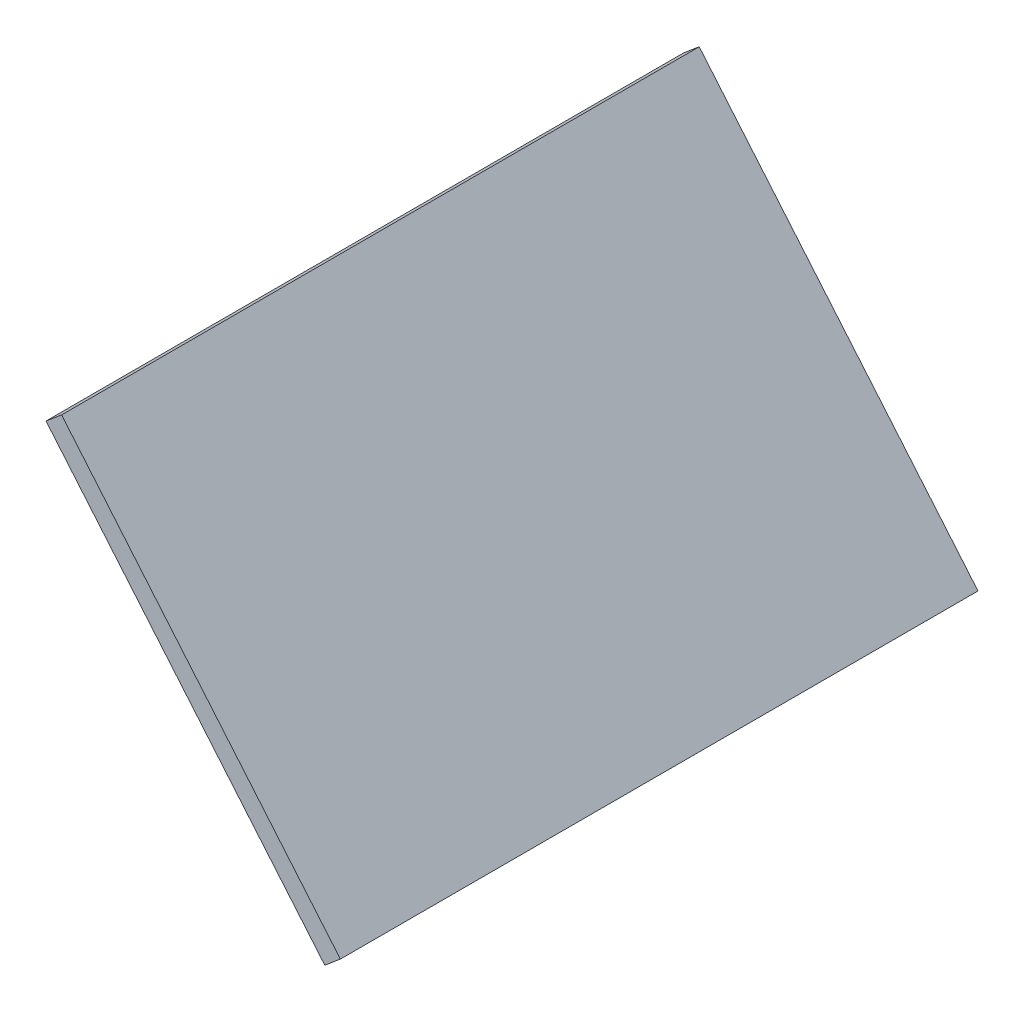
from build123d import *

# Parameters (mm, degrees)
BOSS_EXTRUDE1_DEPTH = 38.1
BOSS_EXTRUDE2_DEPTH = 76.2


with BuildPart() as part:
    # Sketch1 → Boss-Extrude1 (new, symmetric)
    with BuildSketch(Plane.XY):
        Polygon((-16.002, 38.1), (16.002, 0), (12.827, 0), (-19.177, 38.1), align=None)
    extrude(amount=BOSS_EXTRUDE1_DEPTH, both=True)

    # Sketch2 → Boss-Extrude2 (add)
    with BuildSketch(Plane.XY.offset(38.1)):
        Polygon((12.827, 0), (14.140484991, -1.563672608), (16.002, 0), align=None)
        Polygon((-16.002, 38.1), (-17.315484991, 39.663672608), (-19.177, 38.1), align=None)
    extrude(amount=-BOSS_EXTRUDE2_DEPTH)


solid = part.part
